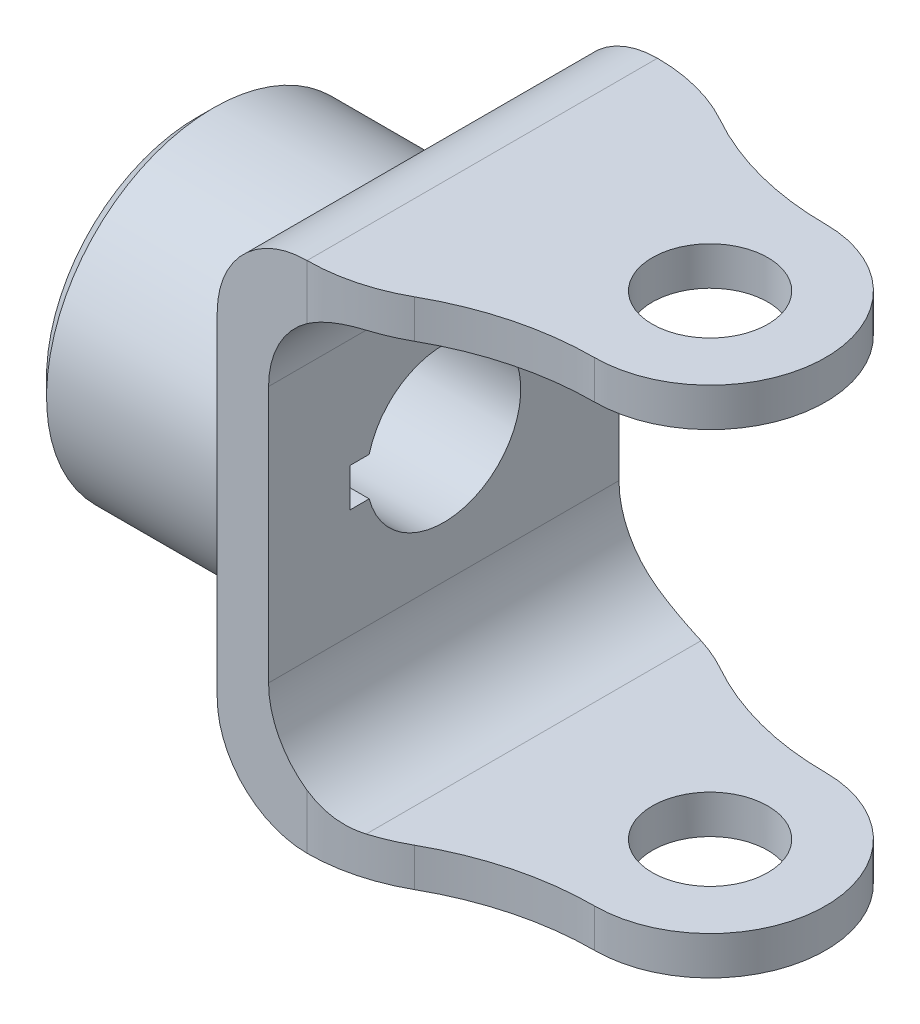
from build123d import *

# Parameters (mm, degrees)
SKETCH1_W           = 30.559375
SKETCH1_H           = 20.6375
BOSS_EXTRUDE6_DEPTH = 31.75
CHAMFER1_SIZE       = 2.06375
EXTRUDE3_DEPTH      = 75.228527622
EXTRUDE3_DEPTH_BACK = 75.228527622
EXTRUDE1_DEPTH      = 75.228527622
EXTRUDE1_DEPTH_BACK = 75.228527622
SKETCH4_R           = 9.525
EXTRUDE4_DEPTH      = 30.559375
EXTRUDE6_DEPTH      = 75.228527694
EXTRUDE6_DEPTH_BACK = 75.228527694
SKETCH6_R           = 7.14375
SKETCH33_W          = 2.38125
SKETCH33_H          = 4.7625
CUT_EXTRUDE1_DEPTH  = 87.767041438
SKETCH34_R          = 4.7625
CUT_EXTRUDE2_DEPTH  = 75.228527694
CUT_EXTRUDE3_DEPTH  = 3.302


with BuildPart() as part:
    # Sketch1 → Revolve1 (revolve)
    with BuildSketch(Plane(origin=(0, 0, 0), x_dir=(1, 0, 0), z_dir=(0, 1, 0)), mode=Mode.PRIVATE) as revolve1_sk:
        with Locations((-48.2203125, 10.31875)):
            Rectangle(SKETCH1_W, SKETCH1_H)
    revolve(revolve1_sk.sketch.rotate(Axis((-63.5, 0, 0), (1, 0, 0)), 180), axis=Axis((-63.5, 0, 0), (1, 0, 0)))

    # Sketch30 → Boss-Extrude6 (add, symmetric)
    with BuildSketch(Plane(origin=(0, 0, 0), x_dir=(1, 0, 0), z_dir=(0, 1, 0))):
        Polygon((-39.290625, 21.669375), (-39.290625, -21.669375), (-21.828125, -21.669375), (14.2875, -21.669375), (14.2875, 21.669375), (-21.828125, 21.669375), align=None)
    extrude(amount=BOSS_EXTRUDE6_DEPTH, both=True)

    # Chamfer1
    chamfer1_edges = [part.edges().sort_by_distance(p)[0] for p in [
        (-63.5, 0, -20.6375),
    ]]
    chamfer(chamfer1_edges, length=CHAMFER1_SIZE)

    # Sketch3 → Extrude3 (cut, two sides: drawn at the far end of the back side and taken through both)
    with BuildSketch(Plane.XY.offset(-EXTRUDE3_DEPTH_BACK)):
        with BuildLine():
            Line((-21.828125, 26.9875), (32.940625, 26.9875))
            Line((32.940625, 26.9875), (32.940625, -26.9875))
            Line((32.940625, -26.9875), (-21.828125, -26.9875))
            ThreePointArc((-21.828125, -26.9875), (-29.685849106, -23.732724106), (-32.940625, -15.875))
            Line((-32.940625, -15.875), (-32.940625, 15.875))
            ThreePointArc((-32.940625, 15.875), (-29.685849106, 23.732724106), (-21.828125, 26.9875))
        make_face()
        with BuildLine():
            Line((-39.290625, 31.75), (-28.178125, 31.75))
            ThreePointArc((-28.178125, 31.75), (-36.035849106, 28.495224106), (-39.290625, 20.6375))
            Line((-39.290625, 20.6375), (-39.290625, 31.75))
        make_face()
        with BuildLine():
            Line((-39.290625, -31.75), (-39.290625, -20.6375))
            ThreePointArc((-39.290625, -20.6375), (-36.035849106, -28.495224106), (-28.178125, -31.75))
            Line((-28.178125, -31.75), (-39.290625, -31.75))
        make_face()
    extrude(amount=EXTRUDE3_DEPTH + EXTRUDE3_DEPTH_BACK, mode=Mode.SUBTRACT)

    # Sketch2 → Extrude1 (cut, two sides: drawn at the far end of the back side and taken through both)
    with BuildSketch(Plane(origin=(0, 0, 0), x_dir=(1, 0, 0), z_dir=(0, 1, 0)).offset(-EXTRUDE1_DEPTH_BACK)):
        with BuildLine():
            Line((20.6375, 31.75), (20.6375, -31.75))
            Line((20.6375, -31.75), (-21.828125, -31.75))
            Line((-21.828125, -31.75), (-28.178125, -21.669375))
            ThreePointArc((-28.178125, -21.669375), (-22.727549003, -20.967272623), (-17.632826724, -18.906803902))
            ThreePointArc((-17.632826724, -18.906803902), (-9.113925428, -15.461487614), (0, -14.2875))
            ThreePointArc((0, -14.2875), (14.2875, 0), (0, 14.2875))
            ThreePointArc((0, 14.2875), (-9.113925428, 15.461487614), (-17.632826724, 18.906803902))
            ThreePointArc((-17.632826724, 18.906803902), (-22.727549003, 20.967272623), (-28.178125, 21.669375))
            Line((-28.178125, 21.669375), (-21.828125, 31.75))
            Line((-21.828125, 31.75), (20.6375, 31.75))
        make_face()
    extrude(amount=EXTRUDE1_DEPTH + EXTRUDE1_DEPTH_BACK, mode=Mode.SUBTRACT)

    # Sketch4 → Extrude4 (cut)
    with BuildSketch(Plane.ZY.offset(63.5)):
        Circle(SKETCH4_R)
    extrude(amount=-EXTRUDE4_DEPTH, mode=Mode.SUBTRACT)

    # Sketch6 → Extrude6 (cut, two sides: drawn at the far end of the back side and taken through both)
    with BuildSketch(Plane(origin=(0, 0, 0), x_dir=(1, 0, 0), z_dir=(0, 1, 0)).offset(-EXTRUDE6_DEPTH_BACK)):
        with Locations(Location((0, 0, 0), (0, 0, 270))):
            Circle(SKETCH6_R)
    extrude(amount=EXTRUDE6_DEPTH + EXTRUDE6_DEPTH_BACK, mode=Mode.SUBTRACT)

    # Sketch33 → Cut-Extrude1 (cut, through all)
    with BuildSketch(Plane.ZY.offset(63.5)):
        with Locations((10.413166593, 0)):
            Rectangle(SKETCH33_W, SKETCH33_H)
    extrude(amount=-CUT_EXTRUDE1_DEPTH, mode=Mode.SUBTRACT)

    # Sketch34 → Cut-Extrude2 (cut, through all)
    with BuildSketch(Plane(origin=(0, 0, 0), x_dir=(1, 0, 0), z_dir=(0, 1, 0))):
        with Locations(Location((-51.3953125, 0, 0), (0, 0, 270))):
            Circle(SKETCH34_R)
    extrude(amount=-CUT_EXTRUDE2_DEPTH, mode=Mode.SUBTRACT)

    # Sketch35 → Revolve2 (revolve)
    with BuildSketch(Plane(origin=(-51.3953125, 0, 0), x_dir=(0, 0, -1), z_dir=(1, 0, 0))):
        Polygon((-3.96875, -9.525), (-4.7625, -10.31875), (-4.7625, -21.43125), (-3.96875, -22.225), (0, -22.225), (0, -9.525), align=None)
    revolve(axis=Axis((-51.3953125, -9.525, 0), (0, -1, 0)))

    # Sketch36 → Cut-Extrude3 (cut)
    with BuildSketch(Plane.XZ.offset(22.225)):
        Polygon((-51.3953125, -2.749630657), (-49.0140625, -1.374815329), (-49.0140625, 1.374815329), (-51.3953125, 2.749630657), (-53.7765625, 1.374815329), (-53.7765625, -1.374815329), align=None)
    extrude(amount=-CUT_EXTRUDE3_DEPTH, mode=Mode.SUBTRACT)

    # Cut-Extrude4 cone 1 section (through the dimple's axis) → Cut-Extrude4 (revolve, cut)
    with BuildSketch(Plane(origin=(-51.3953125, -22.225, 0), x_dir=(0, 0, -1), z_dir=(1, 0, 0))):
        Polygon((0, 0), (2.749630657, 0), (0, 2.749630657), align=None)
    revolve(axis=Axis((-51.3953125, -22.225, 0), (0, 1, 0)), mode=Mode.SUBTRACT)


solid = part.part
